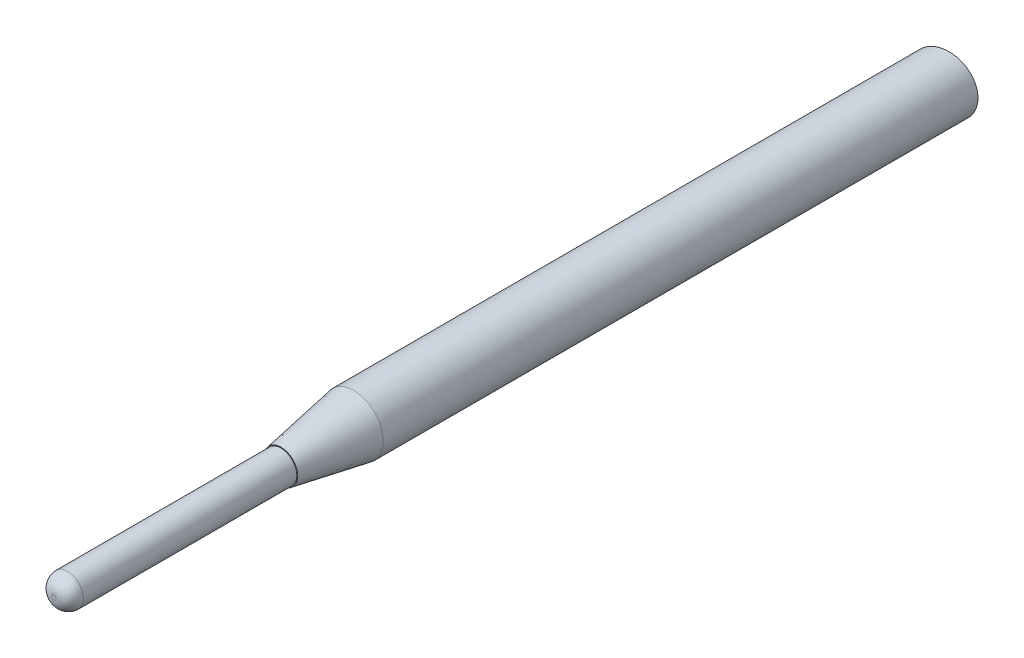
from build123d import *

# Parameters (mm, degrees)
ESQUISSE1_R                  = 6.5
BOSS_EXTRU_1_DEPTH           = 147
ESQUISSE2_R                  = 3.5
BOSS_EXTRU_2_DEPTH           = 50
CONG_1_R                     = 3
CHANFREIN1_SIZE              = 16
CHANFREIN1_SIZE2             = 2.821231691
ENL_V_MAT_EXTRU_1_DEPTH      = 198.214350391
ENL_V_MAT_EXTRU_1_DEPTH_BACK = 198.214350391
ENL_V_MAT_EXTRU_2_DEPTH      = 5


with BuildPart() as part:
    # Esquisse1 → Boss.-Extru.1 (new body)
    with BuildSketch(Plane.XY):
        Circle(ESQUISSE1_R)
    extrude(amount=BOSS_EXTRU_1_DEPTH)

    # Esquisse2 → Boss.-Extru.2 (add)
    with BuildSketch(Plane.XY.offset(147)):
        Circle(ESQUISSE2_R)
    extrude(amount=BOSS_EXTRU_2_DEPTH)

    # Congé1
    cong_1_edges = [part.edges().sort_by_distance(p)[0] for p in [
        (-3.5, 0, 197),
    ]]
    fillet(cong_1_edges, radius=CONG_1_R)

    # Chanfrein1
    chanfrein1_edges = [part.edges().sort_by_distance(p)[0] for p in [
        (-6.5, 0, 147),
    ]]
    chanfrein1_side = [part.faces().sort_by_distance(p)[0] for p in [
        (-6.5, 0, 73.5),
    ]]
    chamfer(chanfrein1_edges, length=CHANFREIN1_SIZE, length2=CHANFREIN1_SIZE2, reference=chanfrein1_side[0])

    # Esquisse3 → Enlèv. mat.-Extru.1 (cut, two sides: drawn at the far end of the back side and taken through both)
    with BuildSketch(Plane(origin=(0, 0, 0), x_dir=(1, 0, 0), z_dir=(0, 1, 0)).offset(-ENL_V_MAT_EXTRU_1_DEPTH_BACK)):
        Polygon((6.5, 0), (-6.5, -1.827030851), (-6.5, 0), align=None)
    extrude(amount=ENL_V_MAT_EXTRU_1_DEPTH + ENL_V_MAT_EXTRU_1_DEPTH_BACK, mode=Mode.SUBTRACT)

    # Esquisse4 → Enlèv. mat.-Extru.2 (cut)
    with BuildSketch(Plane(origin=(0.125899488, 0, 0.895821406), x_dir=(-0.9902680687415714, 0, 0.1391731009600587), z_dir=(-0.1391731009600587, 0, -0.9902680687415714))):
        with BuildLine():
            Line((-1.607582844, 1.189822423), (-1.607582844, -1.189822423))
            ThreePointArc((-1.607582844, -1.189822423), (2, 0), (-1.607582844, 1.189822423))
        make_face()
    extrude(amount=-ENL_V_MAT_EXTRU_2_DEPTH, mode=Mode.SUBTRACT)


solid = part.part
